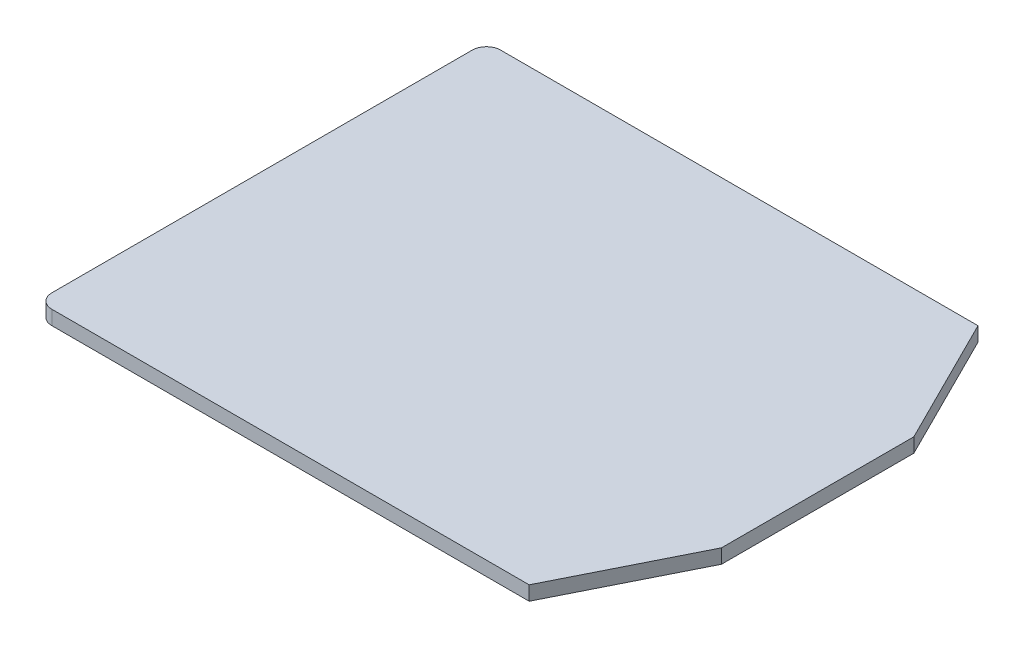
from build123d import *

# Parameters (mm, degrees)
SALIENTE_EXTRUIR1_DEPTH = 2
REDONDEO1_R             = 2
CROQUIS4_R              = 3
SALIENTE_EXTRUIR2_DEPTH = 7
REDONDEO2_R             = 2


with BuildPart() as part:
    # Croquis1 → Saliente-Extruir1 (new body)
    with BuildSketch(Plane(origin=(0, 0, 0), x_dir=(1, 0, 0), z_dir=(0, 1, 0))):
        Polygon((63, 0), (69, 0), (78, 18), (78, 45), (69, 63), (63, 63), (0, 63), (0, 0), align=None)
    extrude(amount=SALIENTE_EXTRUIR1_DEPTH)

    # Redondeo1
    redondeo1_edges = [part.edges().sort_by_distance(p)[0] for p in [
        (0, 1, -63),
        (0, 1, 0),
    ]]
    fillet(redondeo1_edges, radius=REDONDEO1_R)

    # Croquis4 → Saliente-Extruir2 (add)
    with BuildSketch(Plane(origin=(0, 2, 0), x_dir=(1, 0, 0), z_dir=(0, 1, 0))):
        with Locations(Location((20, 47.25, 0), (0, 0, 270))):
            Circle(CROQUIS4_R)
        with Locations(Location((20, 15.75, 0), (0, 0, 270))):
            Circle(CROQUIS4_R)
        with Locations(Location((58, 31.5, 0), (0, 0, 270))):
            Circle(CROQUIS4_R)
    extrude(amount=-SALIENTE_EXTRUIR2_DEPTH)

    # Redondeo2
    redondeo2_edges = [part.edges().sort_by_distance(p)[0] for p in [
        (20, -5, -50.25),
        (20, -5, -18.75),
        (58, -5, -34.5),
    ]]
    fillet(redondeo2_edges, radius=REDONDEO2_R)


solid = part.part
